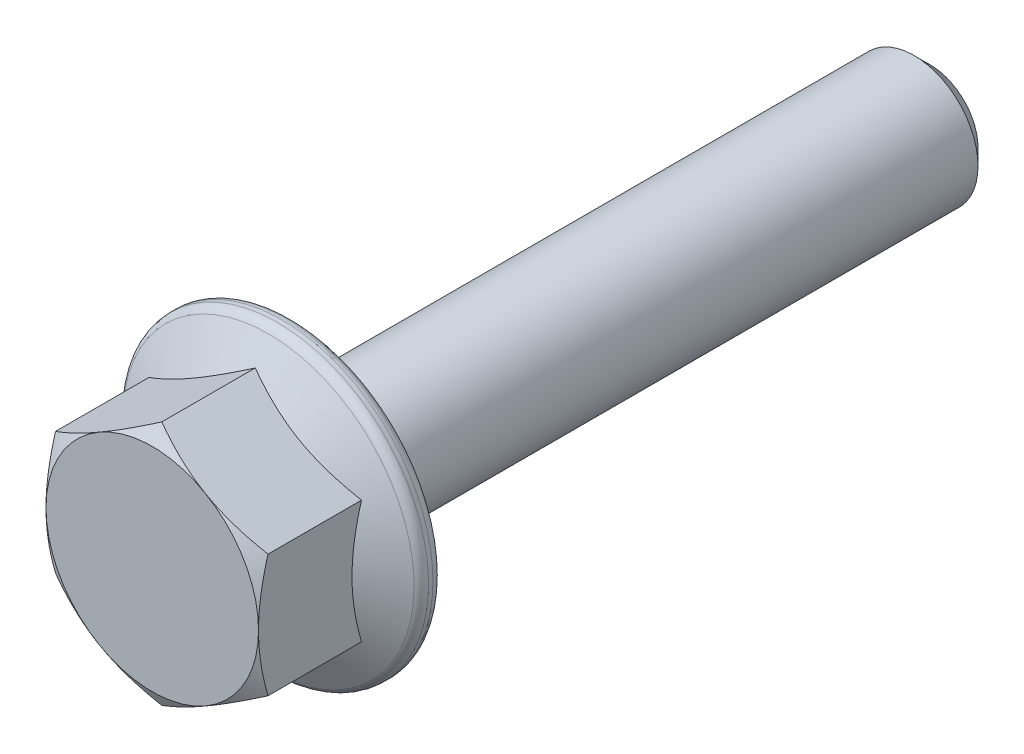
from build123d import *

# Parameters (mm, degrees)
EXTRUDE1_DEPTH     = 6.6
SKETCH2_R          = 7.1
EXTRUDE2_DEPTH     = 0.99
SKETCH15_OUTSIDE_W = 43.29
SKETCH15_OUTSIDE_H = 43.29
SKETCH15_OUTSIDE_R = 5
CUT_EXTRUDE5_DEPTH = 6.6
CUT_EXTRUDE5_DRAFT = -60
SKETCH5_W          = 30
SKETCH5_H          = 3
CHAMFER1_SIZE      = 0.75
SKETCH11_R         = 7.1
EXTRUDE3_DEPTH     = 3.3
EXTRUDE3_TAPER     = 60
FILLET1_R          = 0.495


with BuildPart() as part:
    # Sketch1 → Extrude1 (new body)
    with BuildSketch(Plane.XY):
        Polygon((5, -2.886751346), (5, 2.886751346), (0, 5.773502692), (-5, 2.886751346), (-5, -2.886751346), (0, -5.773502692), align=None)
    extrude(amount=EXTRUDE1_DEPTH)

    # Sketch2 → Extrude2 (add)
    with BuildSketch(Plane(origin=(0, 0, 0), x_dir=(-1, 0, 0), z_dir=(0, 0, -1))):
        Circle(SKETCH2_R)
    extrude(amount=-EXTRUDE2_DEPTH)


with BuildPart() as cut_extrude5_tool:
    # Sketch15 outside → Cut-Extrude5 (with draft: the straight prism first)
    with BuildSketch(Plane.XY.offset(6.6)):
        Rectangle(SKETCH15_OUTSIDE_W, SKETCH15_OUTSIDE_H)
        Circle(SKETCH15_OUTSIDE_R, mode=Mode.SUBTRACT)
    extrude(amount=-CUT_EXTRUDE5_DEPTH)
    # Cut-Extrude5: the draft: its side faces are tilted about the plane it starts from
    cut_extrude5_sides = [cut_extrude5_tool.faces().sort_by_distance(p)[0] for p in [
        (0, -21.645, 3.3),
        (21.645, 0, 3.3),
        (0, 21.645, 3.3),
        (-21.645, 0, 3.3),
        (-5, 0, 3.3),
    ]]
    draft(cut_extrude5_sides, Plane.XY.offset(6.6), CUT_EXTRUDE5_DRAFT)


with BuildPart() as part_1:
    add(part.part)

    # Cut-Extrude5: cut by cut_extrude5_tool
    add(cut_extrude5_tool.part, mode=Mode.SUBTRACT)


with BuildPart() as body_2:
    # Sketch5 → Revolve1 (revolve)
    with BuildSketch(Plane(origin=(0, 0, 0), x_dir=(0, 0, -1), z_dir=(1, 0, 0))):
        with Locations((15, 1.5)):
            Rectangle(SKETCH5_W, SKETCH5_H)
    revolve(axis=Axis((0, 0, -30), (0, 0, -1)))

    # Chamfer1
    chamfer1_edges = [body_2.edges().sort_by_distance(p)[0] for p in [
        (0, -3, -30),
    ]]
    chamfer(chamfer1_edges, length=CHAMFER1_SIZE)


with BuildPart() as part_2:
    add(part_1.part)

    # Combine1: union body 2
    add(body_2.part)

    # Sketch10 → Revolve2 (revolve)
    with BuildSketch(Plane(origin=(0, 0, 0), x_dir=(0, 0, -1), z_dir=(1, 0, 0))):
        Polygon((12, 2.350480947), (11.697124292, 3), (-0.875, 3), (-0.875, 0), (12, 0), align=None)
    revolve(axis=Axis((0, 0, 0.875), (0, 0, -1)))

    # Sketch11 → Extrude3 (add)
    with BuildSketch(Plane.XY.offset(0.99)):
        Circle(SKETCH11_R)
    extrude(amount=EXTRUDE3_DEPTH, taper=EXTRUDE3_TAPER)

    # Fillet1
    fillet1_edges = [part_2.edges().sort_by_distance(p)[0] for p in [
        (7.1, 0, 0),
        (0, -7.1, 0.99),
    ]]
    fillet(fillet1_edges, radius=FILLET1_R)


solid = part_2.part
